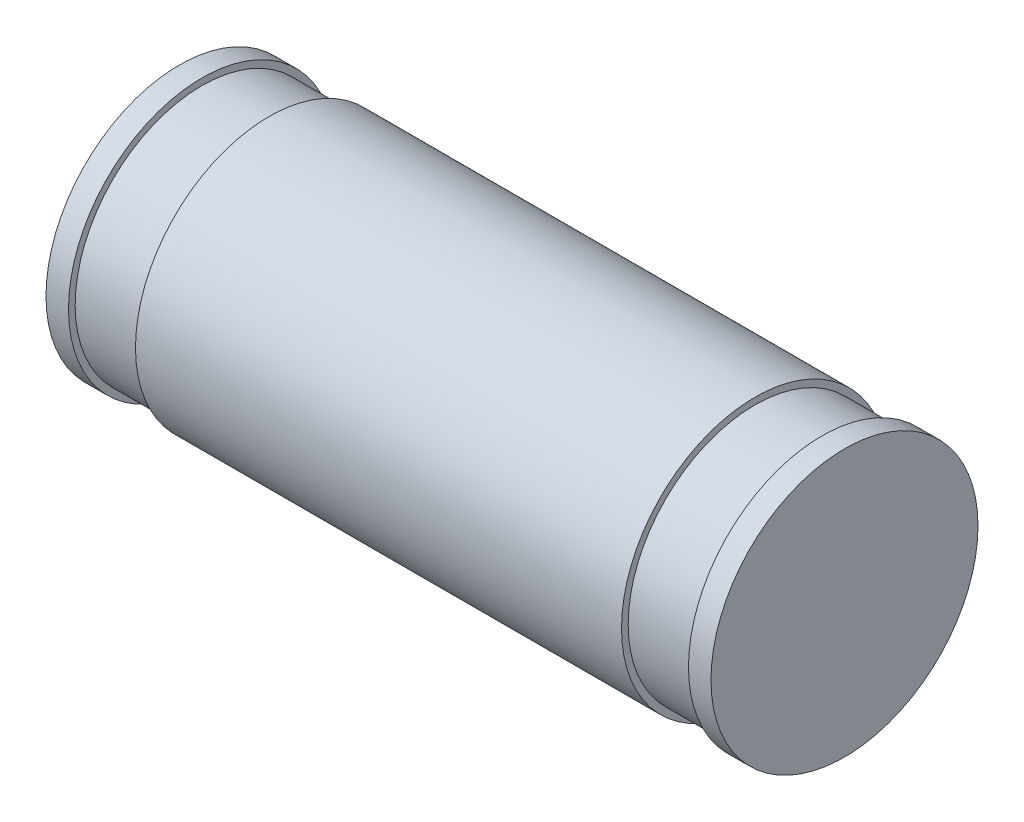
from build123d import *


with BuildPart() as part:
    # Sketch1 → Revolve1 (revolve)
    with BuildSketch(Plane(origin=(0, 0, 0), x_dir=(1, 0, 0), z_dir=(0, 1, 0))):
        Polygon((8.874, 0), (8.874, 4), (8.2, 4), (8.2, 3.8), (6.1934, 3.8), (6.1934, 4), (-8.3684, 4), (-8.3684, 3.8), (-10.375, 3.8), (-10.375, 4), (-11.049, 4), (-11.049, 0), align=None)
    revolve(axis=Axis((12.002305384, 0, 0), (-1, 0, 0)))


solid = part.part
